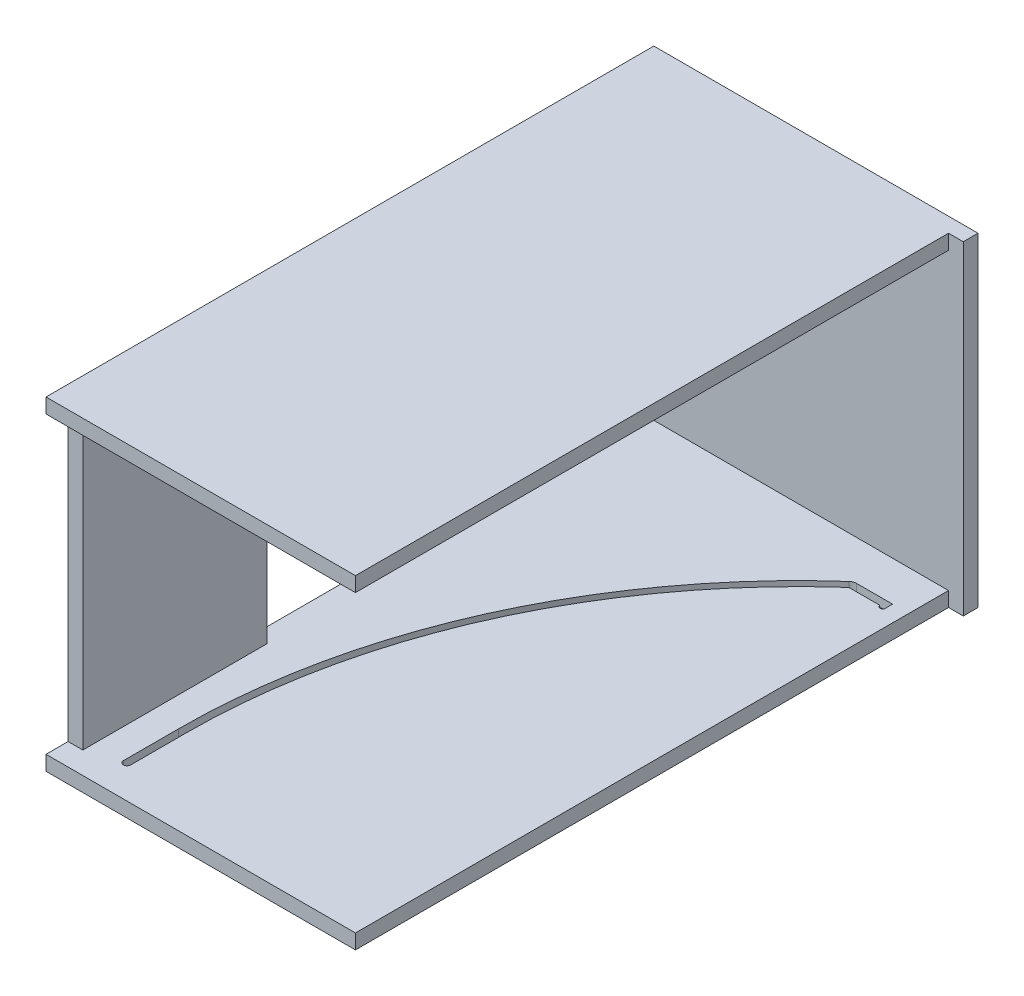
from build123d import *

# Parameters (mm, degrees)
SKETCH1_W           = 440
SKETCH1_H           = 440
BOSS_EXTRUDE1_DEPTH = 20
SKETCH2_W           = 420
SKETCH2_H           = 20
BOSS_EXTRUDE2_DEPTH = 805
SKETCH3_W           = 20
SKETCH3_H           = 250
BOSS_EXTRUDE3_DEPTH = 400
SKETCH4_W           = 20
SKETCH4_H           = 250
BOSS_EXTRUDE4_DEPTH = 400
CUT_EXTRUDE1_DEPTH  = 12


with BuildPart() as part:
    # Sketch1 → Boss-Extrude1 (new body)
    with BuildSketch(Plane.XY):
        Rectangle(SKETCH1_W, SKETCH1_H)
    extrude(amount=BOSS_EXTRUDE1_DEPTH)

    # Sketch2 → Boss-Extrude2 (add)
    with BuildSketch(Plane.XY.offset(20)):
        with Locations((-10, -210)):
            Rectangle(SKETCH2_W, SKETCH2_H)
    boss_extrude2 = extrude(amount=BOSS_EXTRUDE2_DEPTH)

    # Sketch3 → Boss-Extrude3 (add)
    with BuildSketch(Plane(origin=(0, -200, 0), x_dir=(1, 0, 0), z_dir=(0, 1, 0))):
        with Locations((-210, -145)):
            Rectangle(SKETCH3_W, SKETCH3_H)
    extrude(amount=BOSS_EXTRUDE3_DEPTH)

    # Sketch4 → Boss-Extrude4 (add)
    with BuildSketch(Plane(origin=(0, -200, 0), x_dir=(1, 0, 0), z_dir=(0, 1, 0))):
        with Locations((-210, -670)):
            Rectangle(SKETCH4_W, SKETCH4_H)
    extrude(amount=BOSS_EXTRUDE4_DEPTH)

    # Sketch5 → Cut-Extrude1 (cut)
    with BuildSketch(Plane(origin=(0, -200, 0), x_dir=(1, 0, 0), z_dir=(0, 1, 0))):
        with BuildLine():
            ThreePointArc((-150, -705), (-77.574670949, -365.69256628), (127.077366481, -85.527424904))
            ThreePointArc((127.077366481, -85.527424904), (128.936250611, -84.394848326), (131.076875452, -84))
            Line((131.076875452, -84), (169.376524617, -84))
            ThreePointArc((169.376524617, -84), (170.504676767, -84.348554352), (171.239606574, -85.272727273))
            ThreePointArc((171.239606574, -85.272727273), (175.147542667, -87.43957679), (178, -84))
            Line((178, -84), (178, -74))
            Line((178, -74), (129.170663521, -74))
            ThreePointArc((129.170663521, -74), (125.25802282, -74.719375372), (121.857138002, -76.783410411))
            ThreePointArc((121.857138002, -76.783410411), (-86.307144971, -360.725571064), (-160, -705))
            Line((-160, -705), (-160, -780))
            ThreePointArc((-160, -780), (-155, -785), (-150, -780))
            Line((-150, -780), (-150, -705))
        make_face()
    cut_extrude1 = extrude(amount=-CUT_EXTRUDE1_DEPTH, mode=Mode.SUBTRACT)

    # Mirror1: Boss-Extrude2, Cut-Extrude1 across plane
    add(boss_extrude2.mirror(Plane.ZX))
    add(cut_extrude1.mirror(Plane.ZX), mode=Mode.SUBTRACT)


solid = part.part
